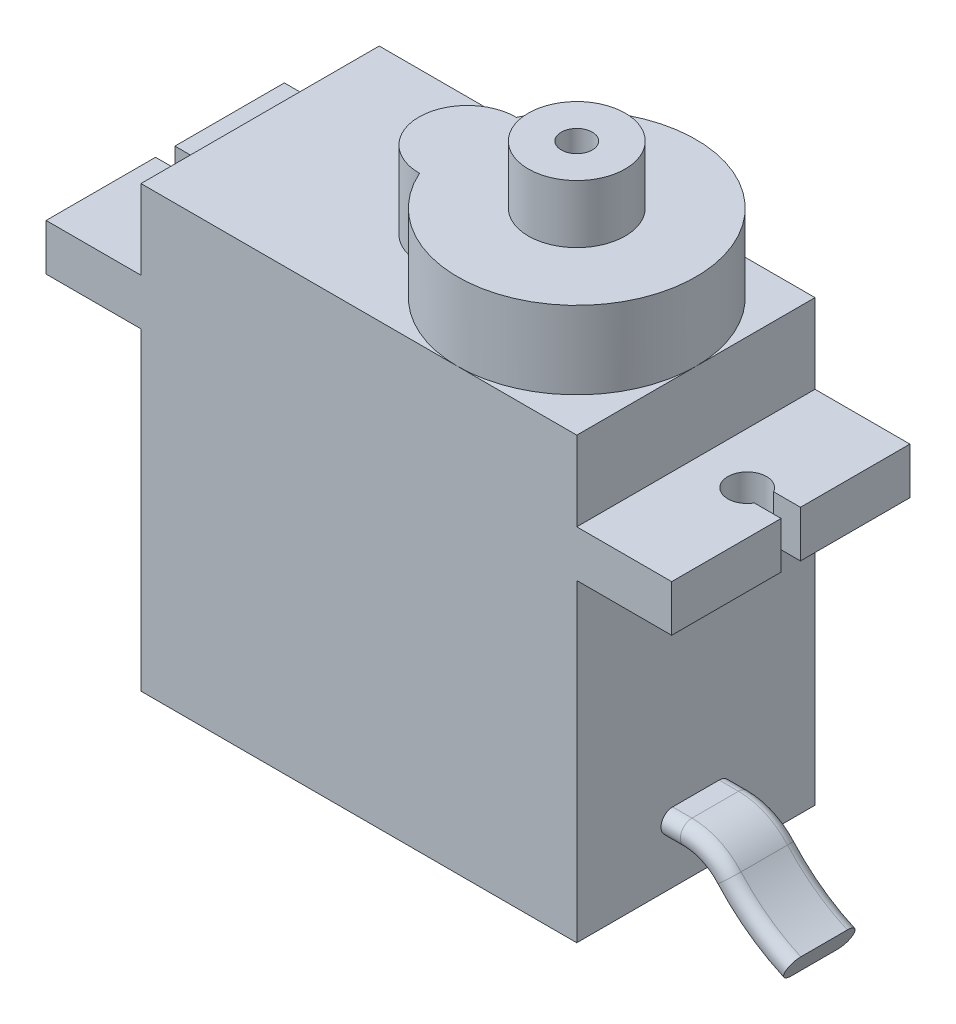
from build123d import *

# Parameters (mm, degrees)
SKETCH1_R               = 6.15
BOSS_EXTRUDE1_DEPTH     = 4
SKETCH2_W               = 22.5
SKETCH2_H               = 12.3
BOSS_EXTRUDE2_DEPTH     = 4.1
BOSS_EXTRUDE3_DEPTH     = 2.4
SKETCH4_W               = 22.5
SKETCH4_H               = 12.3
BOSS_EXTRUDE4_DEPTH     = 23
CUT_EXTRUDE1_DEPTH      = 39.381017444
CUT_EXTRUDE1_DEPTH_BACK = 39.381017444
SKETCH6_R               = 2.5
BOSS_EXTRUDE5_DEPTH     = 23
SKETCH7_R               = 2.5
SKETCH7_R_2             = 0.8
BOSS_EXTRUDE6_DEPTH     = 3
SCALE1_SCALE            = 2


with BuildPart() as part:
    # Sketch1 → Boss-Extrude1 (new body)
    with BuildSketch(Plane(origin=(0, 0, 0), x_dir=(1, 0, 0), z_dir=(0, 1, 0))):
        with Locations(Location((0, 0, 0), (0, 0, 270))):
            Circle(SKETCH1_R)
    extrude(amount=BOSS_EXTRUDE1_DEPTH)

    # Sketch2 → Boss-Extrude2 (add)
    with BuildSketch(Plane(origin=(0, 0, 0), x_dir=(1, 0, 0), z_dir=(0, 1, 0))):
        with Locations((-5.1, 0)):
            Rectangle(SKETCH2_W, SKETCH2_H)
    extrude(amount=-BOSS_EXTRUDE2_DEPTH)

    # Sketch3 → Boss-Extrude3 (add)
    with BuildSketch(Plane.XZ.offset(4.1)):
        with BuildLine():
            Line((-21.25, 6.15), (11.05, 6.15))
            Line((11.05, 6.15), (11.05, 0.5))
            Line((11.05, 0.5), (9.666025404, 0.5))
            ThreePointArc((9.666025404, 0.5), (7.8, 0), (9.666025404, -0.5))
            Line((9.666025404, -0.5), (11.05, -0.5))
            Line((11.05, -0.5), (11.05, -6.15))
            Line((11.05, -6.15), (-21.25, -6.15))
            Line((-21.25, -6.15), (-21.25, -0.5))
            Line((-21.25, -0.5), (-19.866025404, -0.5))
            ThreePointArc((-19.866025404, -0.5), (-18, 0), (-19.866025404, 0.5))
            Line((-19.866025404, 0.5), (-21.25, 0.5))
            Line((-21.25, 0.5), (-21.25, 6.15))
        make_face()
    extrude(amount=BOSS_EXTRUDE3_DEPTH)

    # Sketch4 → Boss-Extrude4 (add)
    with BuildSketch(Plane.XZ.offset(6.5)):
        with Locations((-5.1, 0)):
            Rectangle(SKETCH4_W, SKETCH4_H)
    extrude(amount=BOSS_EXTRUDE4_DEPTH)

    # Sketch5 → Cut-Extrude1 (cut, two sides: drawn at the far end of the back side and taken through both)
    with BuildSketch(Plane.XY.offset(6.15).offset(-CUT_EXTRUDE1_DEPTH_BACK)):
        Polygon((113.386591398, -22.7), (14.208205906, -22.7), (-24.661428279, -22.7), (-123.83981377, -22.7), (-123.83981377, -221.056770983), (113.386591398, -221.056770983), align=None)
    extrude(amount=CUT_EXTRUDE1_DEPTH + CUT_EXTRUDE1_DEPTH_BACK, mode=Mode.SUBTRACT)

    # Sketch6 → Boss-Extrude5 (add)
    with BuildSketch(Plane(origin=(0, 4, 0), x_dir=(1, 0, 0), z_dir=(0, 1, 0))):
        with Locations((-5.65, 0)):
            Circle(SKETCH6_R)
    extrude(amount=-BOSS_EXTRUDE5_DEPTH)

    # Sketch7 → Boss-Extrude6 (add)
    with BuildSketch(Plane(origin=(0, 4, 0), x_dir=(1, 0, 0), z_dir=(0, 1, 0))):
        with Locations(Location((0, 0, 0), (0, 0, 270))):
            Circle(SKETCH7_R)
        with Locations(Location((0, 0, 0), (0, 0, 270))):
            Circle(SKETCH7_R_2, mode=Mode.SUBTRACT)
    extrude(amount=BOSS_EXTRUDE6_DEPTH)

    # Sweep1: sweep along a path in Sketch9
    with BuildLine(Plane.XY) as sweep1_path:
        Line((6.15, -19.7), (7.149053508, -19.7))
        ThreePointArc((7.149053508, -19.7), (8.291747726, -19.944708597), (9.23401566, -20.63591299))
        ThreePointArc((9.23401566, -20.63591299), (10.752004703, -22.013665811), (12.527651525, -23.038151992))
    # Sketch8 → Sweep1 (sweep)
    with BuildSketch(Plane(origin=(6.15, 0, 0), x_dir=(0, 0, -1), z_dir=(1, 0, 0))):
        with BuildLine():
            Line((-1.2, -19.1), (1.2, -19.1))
            ThreePointArc((1.2, -19.1), (1.8, -19.7), (1.2, -20.3))
            Line((1.2, -20.3), (-1.2, -20.3))
            ThreePointArc((-1.2, -20.3), (-1.8, -19.7), (-1.2, -19.1))
        make_face()
    sweep(path=sweep1_path.line)


with BuildPart() as part_1:
    # Scale1: scaled about (-4.670030393, -10.089014718, 0)
    add(part.part.scale(SCALE1_SCALE).moved(Location((4.670030393, 10.089014718, 0))))


solid = part_1.part
